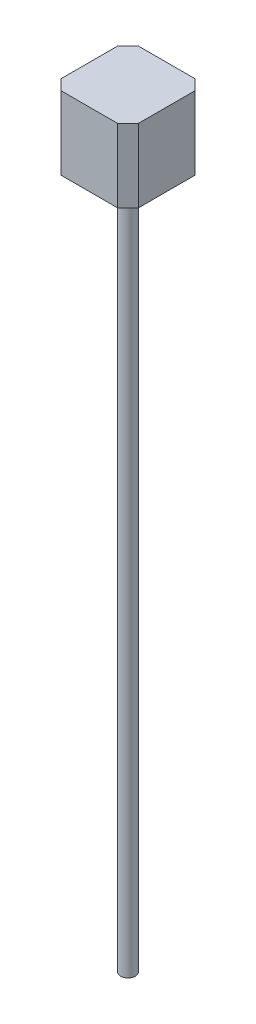
from build123d import *

# Parameters (mm, degrees)
SKETCH_1_R          = 4
EXTRUDE_1_DEPTH     = 380
SKETCH_5_W          = 42.3
SKETCH_5_H          = 42.3
EXTRUDE_5_DEPTH     = 40
SKETCH_7_OUTSIDE_W  = 129.148
SKETCH_7_OUTSIDE_H  = 129.148
CUT_EXTRUDE_1_DEPTH = 422.063706581
SKETCH_8_R          = 1.5
CUT_EXTRUDE_2_DEPTH = 4


with BuildPart() as part:
    # 草图1 → 凸台-拉伸1 (new body)
    with BuildSketch(Plane(origin=(0, 0, 0), x_dir=(1, 0, 0), z_dir=(0, 1, 0))):
        with Locations(Location((0, 0, 0), (0, 0, 270))):
            Circle(SKETCH_1_R)
    extrude(amount=EXTRUDE_1_DEPTH)

    # 草图5 → 凸台-拉伸5 (add)
    with BuildSketch(Plane(origin=(0, 380, 0), x_dir=(1, 0, 0), z_dir=(0, 1, 0))):
        Rectangle(SKETCH_5_W, SKETCH_5_H)
    extrude(amount=EXTRUDE_5_DEPTH)

    # 草图7 outside → 切除-拉伸1 (cut, through all)
    with BuildSketch(Plane(origin=(0, 420, 0), x_dir=(1, 0, 0), z_dir=(0, 1, 0))):
        Rectangle(SKETCH_7_OUTSIDE_W, SKETCH_7_OUTSIDE_H)
        Polygon((-15.5, 21.15), (-21.15, 15.5), (-21.15, -15.5), (-15.5, -21.15), (15.5, -21.15), (21.15, -15.5), (21.15, 15.5), (15.5, 21.15), align=None, mode=Mode.SUBTRACT)
    extrude(amount=-CUT_EXTRUDE_1_DEPTH, mode=Mode.SUBTRACT)

    # 草图8 → 切除-拉伸2 (cut)
    with BuildSketch(Plane.XZ.offset(-380)):
        with Locations(Location((-15.5, 15.5, 0), (0, 0, 270))):
            Circle(SKETCH_8_R)
        with Locations(Location((15.5, 15.5, 0), (0, 0, 270))):
            Circle(SKETCH_8_R)
        with Locations(Location((15.5, -15.5, 0), (0, 0, 270))):
            Circle(SKETCH_8_R)
        with Locations(Location((-15.5, -15.5, 0), (0, 0, 270))):
            Circle(SKETCH_8_R)
    extrude(amount=-CUT_EXTRUDE_2_DEPTH, mode=Mode.SUBTRACT)


solid = part.part
